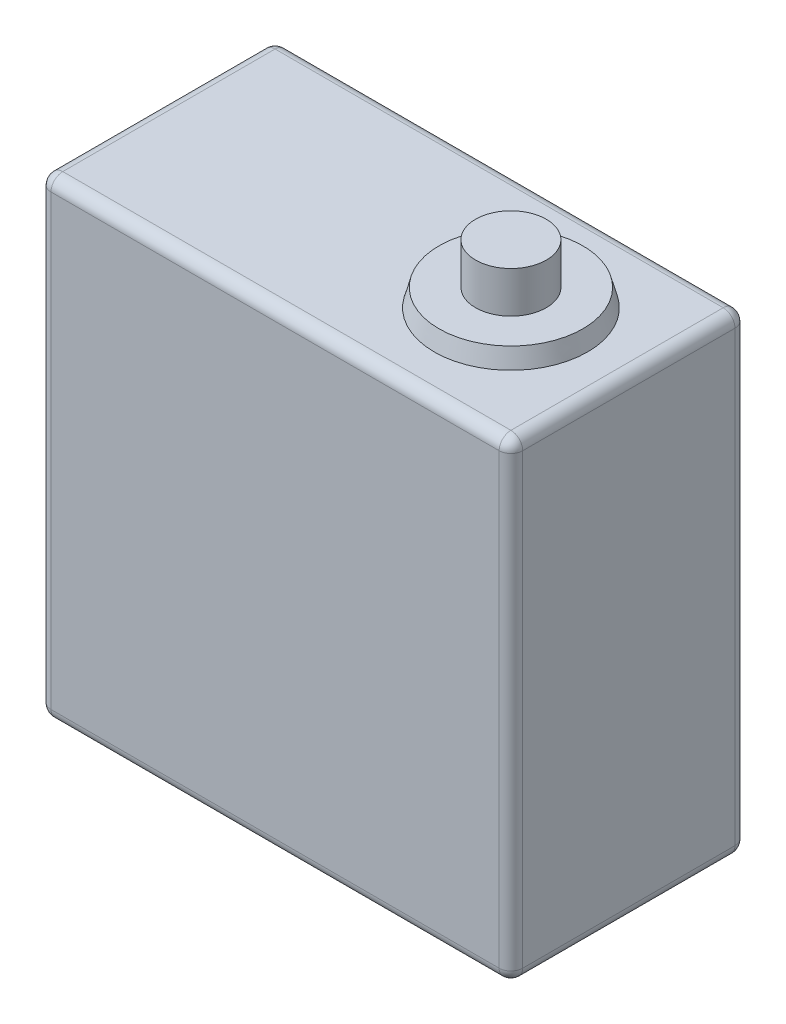
from build123d import *

# Parameters (mm, degrees)
SKETCH_1_W      = 40
SKETCH_1_H      = 40
EXTRUDE_1_DEPTH = 20
FILLET_1_R      = 1
SKETCH_2_R      = 6.5
EXTRUDE_2_DEPTH = 1.5
EXTRUDE_2_TAPER = 15
SKETCH_3_R      = 3
EXTRUDE_3_DEPTH = 3.5
SKETCH_4_R      = 6.5
EXTRUDE_4_DEPTH = 1.5
EXTRUDE_4_TAPER = 15
EXTRUDE_START   = 3.5
SKETCH_5_R      = 3
EXTRUDE_5_DEPTH = 3.5


with BuildPart() as part:
    # 草图1 → 凸台-拉伸1 (new body)
    with BuildSketch(Plane.XY):
        Rectangle(SKETCH_1_W, SKETCH_1_H)
    extrude(amount=EXTRUDE_1_DEPTH)

    # 圆角1
    fillet_1_edges = [part.edges().sort_by_distance(p)[0] for p in [
        (-20, 0, 20),
        (0, -20, 20),
        (20, 0, 20),
        (0, -20, 0),
        (-20, 0, 0),
        (0, 20, 0),
        (20, 0, 0),
        (20, -20, 10),
        (-20, -20, 10),
        (-20, 20, 10),
        (20, 20, 10),
        (0, 20, 20),
    ]]
    fillet(fillet_1_edges, radius=FILLET_1_R)

    # 草图2 → 凸台-拉伸2 (add)
    with BuildSketch(Plane(origin=(0, 20, 0), x_dir=(1, 0, 0), z_dir=(0, 1, 0))):
        with Locations((10, -10)):
            Circle(SKETCH_2_R)
    extrude(amount=EXTRUDE_2_DEPTH, taper=EXTRUDE_2_TAPER)

    # 草图3 → 凸台-拉伸3 (add)
    with BuildSketch(Plane(origin=(0, 21.5, 0), x_dir=(1, 0, 0), z_dir=(0, 1, 0))):
        with Locations(Location((10, -10, 0), (0, 0, 270))):
            Circle(SKETCH_3_R)
    extrude(amount=EXTRUDE_3_DEPTH)

    # 草图4 → 凸台-拉伸4 (add)
    with BuildSketch(Plane.XZ.offset(20)):
        with Locations((10, 10)):
            Circle(SKETCH_4_R)
    extrude(amount=EXTRUDE_4_DEPTH, taper=EXTRUDE_4_TAPER)

    # 草图5 → 凸台-拉伸5 (add)
    with BuildSketch(Plane.XZ.offset(21.5).offset(EXTRUDE_START)):
        with Locations(Location((10, 10, 0), (0, 0, 90))):
            Circle(SKETCH_5_R)
    extrude(amount=-EXTRUDE_5_DEPTH)


solid = part.part
